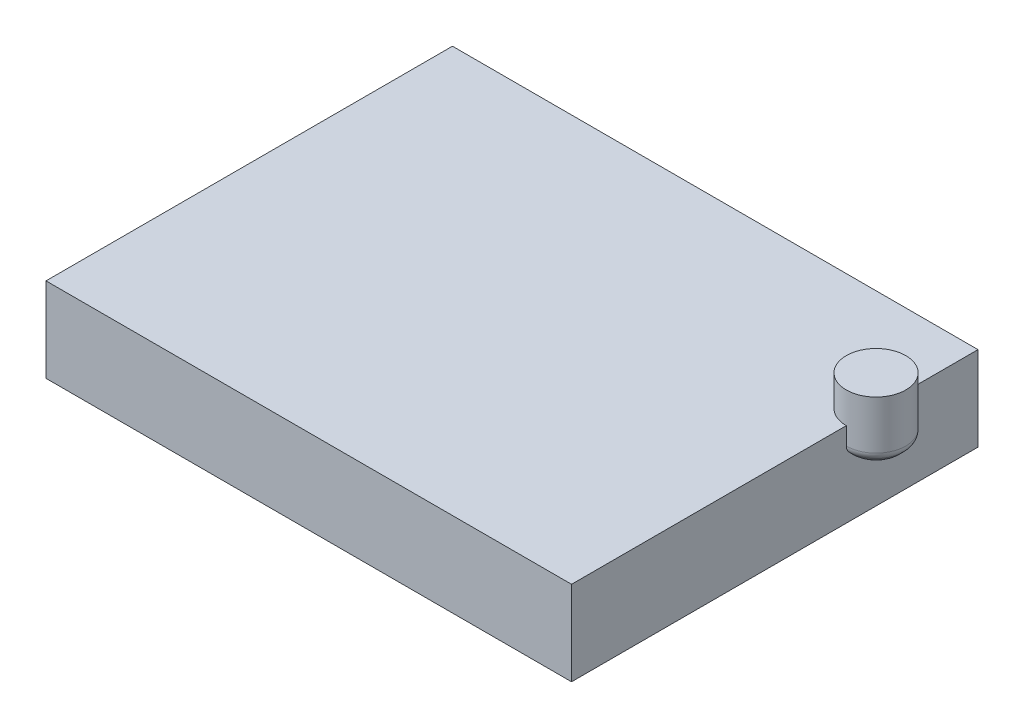
from build123d import *

# Parameters (mm, degrees)
SKETCH1_W      = 137.507065568
SKETCH1_H      = 28.575
EXTRUDE1_DEPTH = 177.8


with BuildPart() as part:
    # Sketch1 → Extrude1 (new body)
    with BuildSketch(Plane(origin=(0, 0, 0), x_dir=(0, 0, -1), z_dir=(1, 0, 0))):
        with Locations((0, 11.1125)):
            Rectangle(SKETCH1_W, SKETCH1_H)
    extrude(amount=-EXTRUDE1_DEPTH)


with BuildPart() as body_2:
    # Sketch2 → Revolve1 (revolve)
    with BuildSketch(Plane(origin=(0, 0, 0), x_dir=(0, 0, -1), z_dir=(1, 0, 0)), mode=Mode.PRIVATE) as revolve1_sk:
        with BuildLine():
            Line((34.263280918, 35.860824198), (34.263280918, 14.939175802))
            Line((34.263280918, 14.939175802), (39.841939145, 14.939175802))
            ThreePointArc((39.841939145, 14.939175802), (41.056959043, 15.180858287), (42.087003175, 15.869111772))
            Line((42.087003175, 15.869111772), (43.402131236, 17.184239833))
            ThreePointArc((43.402131236, 17.184239833), (44.090384721, 18.214283965), (44.332067206, 19.429303863))
            Line((44.332067206, 19.429303863), (44.332067206, 35.860824198))
            Line((44.332067206, 35.860824198), (34.263280918, 35.860824198))
        make_face()
    revolve(revolve1_sk.sketch.rotate(Axis((0, 35.860824198, -34.263280918), (0, -1, 0)), 180), axis=Axis((0, 35.860824198, -34.263280918), (0, -1, 0)))


solid = Compound([part.part, body_2.part])
